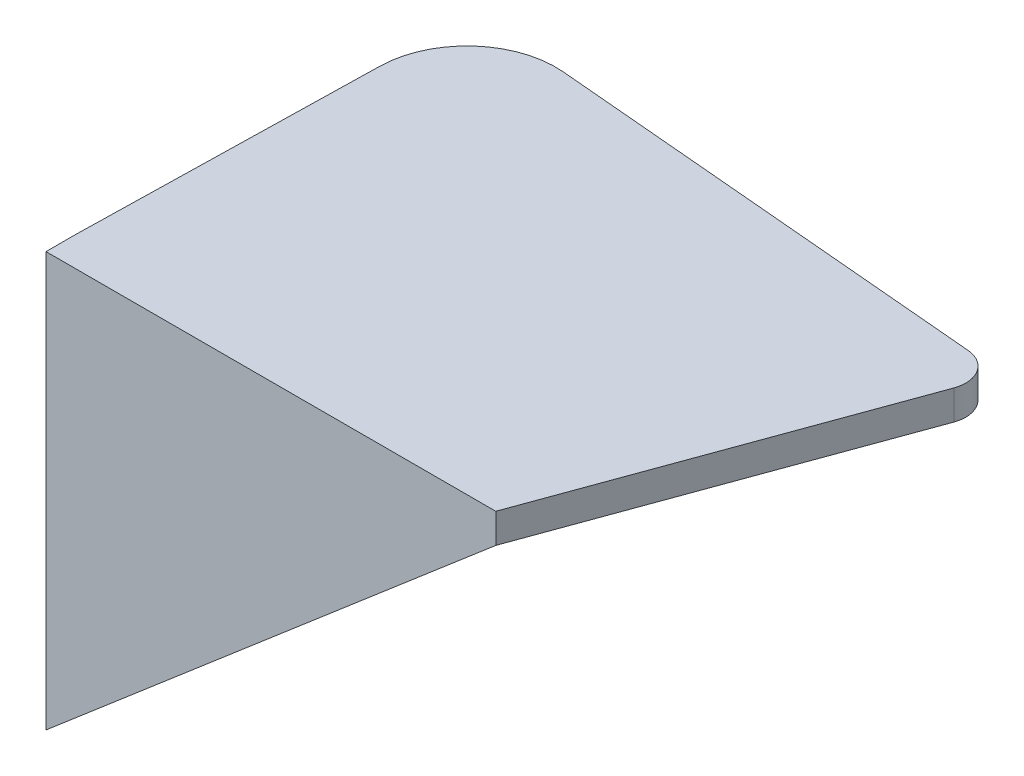
from build123d import *

# Parameters (mm, degrees)
BOSS_EXTRUDE3_DEPTH = 10
BOSS_EXTRUDE4_DEPTH = 10


with BuildPart() as part:
    # Sketch3 → Boss-Extrude3 (new body)
    with BuildSketch(Plane.XY):
        Polygon((0, 0), (151.986841536, 0), (0, -130), align=None)
    extrude(amount=-BOSS_EXTRUDE3_DEPTH)

    # Sketch5 → Boss-Extrude4 (add)
    with BuildSketch(Plane(origin=(0, 0, 0), x_dir=(1, 0, 0), z_dir=(0, 1, 0))):
        with BuildLine():
            Line((0, 0), (151.986841536, 0))
            Line((151.986841536, 0), (193.295480236, 113.494552057))
            ThreePointArc((193.295480236, 113.494552057), (192.332468486, 122.287749574), (184.770111455, 126.876700471))
            Line((184.770111455, 126.876700471), (34.770111455, 140))
            ThreePointArc((34.770111455, 140), (12.126197015, 132.448649393), (2.162345286, 110.757835303))
            Line((2.162345286, 110.757835303), (0, 10))
            Line((0, 10), (0, 0))
        make_face()
    extrude(amount=BOSS_EXTRUDE4_DEPTH)


solid = part.part
